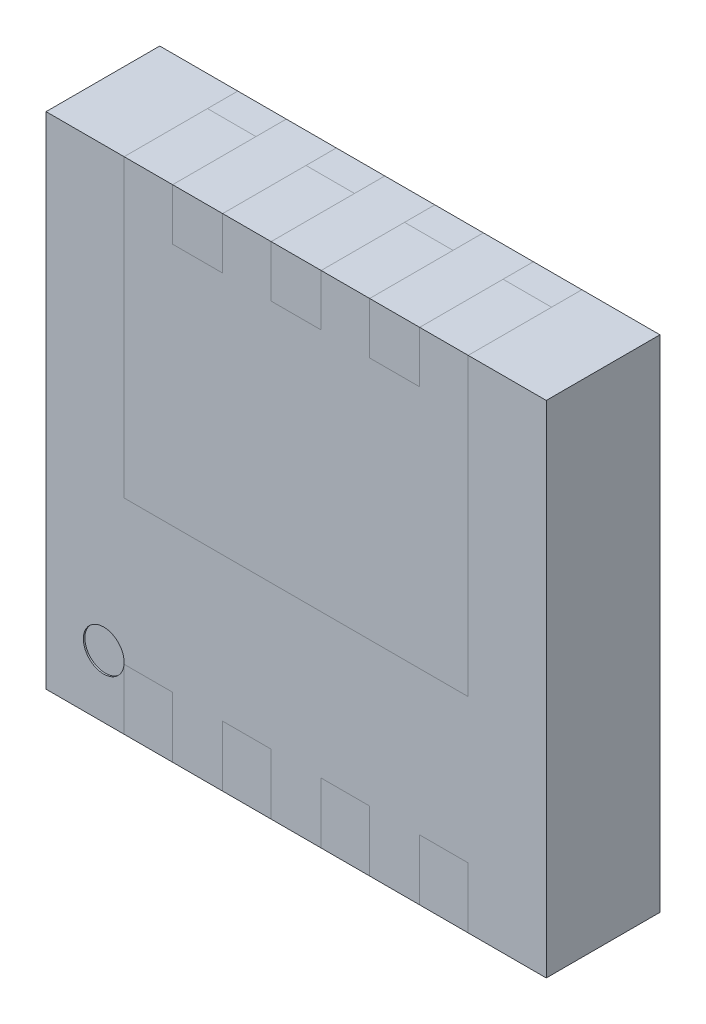
from build123d import *

# Parameters (mm, degrees)
SKETCH1_W             = 0.32
SKETCH1_H             = 0.4
BOSS_EXTRUDE1_DEPTH   = 0.2
BOSS_EXTRUDE1_2_DEPTH = 0.2
BOSS_EXTRUDE1_3_DEPTH = 0.2
BOSS_EXTRUDE1_4_DEPTH = 0.2
BOSS_EXTRUDE1_5_DEPTH = 0.2
BOSS_EXTRUDE4_DEPTH   = 0.75
SKETCH1_5_W           = 0.33
SKETCH1_5_H           = 0.34
BOSS_EXTRUDE4_2_DEPTH = 0.75
BOSS_EXTRUDE4_3_DEPTH = 0.75
BOSS_EXTRUDE4_4_DEPTH = 0.75
BOSS_EXTRUDE7_START   = 0.2
SKETCH1_7_W           = 0.32
SKETCH1_7_H           = 0.4
BOSS_EXTRUDE7_DEPTH   = 0.55
BOSS_EXTRUDE7_2_DEPTH = 0.55
BOSS_EXTRUDE7_3_DEPTH = 0.55
BOSS_EXTRUDE7_4_DEPTH = 0.55
BOSS_EXTRUDE7_5_DEPTH = 0.55
SKETCH3_R             = 0.134470163
CUT_EXTRUDE1_DEPTH    = 0.01


with BuildPart() as part:
    # Sketch1 → Boss-Extrude1 (new body)
    with BuildSketch(Plane.XY):
        with Locations((-0.975, -1.45)):
            Rectangle(SKETCH1_W, SKETCH1_H)
    extrude(amount=BOSS_EXTRUDE1_DEPTH)


with BuildPart() as body_2:
    # Sketch1 → Boss-Extrude1 2 (new body)
    with BuildSketch(Plane.XY):
        Polygon((-0.815, 1.65), (-1.135, 1.65), (-1.135, -0.3), (1.135, -0.3), (1.135, 1.65), (0.815, 1.65), (0.815, 1.31), (0.485, 1.31), (0.485, 1.65), (0.165, 1.65), (0.165, 1.31), (-0.165, 1.31), (-0.165, 1.65), (-0.485, 1.65), (-0.485, 1.31), (-0.815, 1.31), align=None)
    extrude(amount=BOSS_EXTRUDE1_2_DEPTH)


with BuildPart() as body_3:
    # Sketch1 → Boss-Extrude1 3 (new body)
    with BuildSketch(Plane.XY):
        with Locations((-0.325, -1.45)):
            Rectangle(SKETCH1_W, SKETCH1_H)
    extrude(amount=BOSS_EXTRUDE1_3_DEPTH)


with BuildPart() as body_4:
    # Sketch1 → Boss-Extrude1 4 (new body)
    with BuildSketch(Plane.XY):
        with Locations((0.325, -1.45)):
            Rectangle(SKETCH1_W, SKETCH1_H)
    extrude(amount=BOSS_EXTRUDE1_4_DEPTH)


with BuildPart() as body_5:
    # Sketch1 → Boss-Extrude1 5 (new body)
    with BuildSketch(Plane.XY):
        with Locations((0.975, -1.45)):
            Rectangle(SKETCH1_W, SKETCH1_H)
    extrude(amount=BOSS_EXTRUDE1_5_DEPTH)


with BuildPart() as body_6:
    # Sketch1<5> → Boss-Extrude4 (new body)
    with BuildSketch(Plane.XY):
        Polygon((-1.65, 1.65), (-1.65, -1.65), (-1.135, -1.65), (-1.135, -1.25), (-0.815, -1.25), (-0.815, -1.65), (-0.485, -1.65), (-0.485, -1.25), (-0.165, -1.25), (-0.165, -1.65), (0.165, -1.65), (0.165, -1.25), (0.485, -1.25), (0.485, -1.65), (0.815, -1.65), (0.815, -1.25), (1.135, -1.25), (1.135, -1.65), (1.65, -1.65), (1.65, 1.65), (1.135, 1.65), (1.135, -0.3), (-1.135, -0.3), (-1.135, 1.65), align=None)
    extrude(amount=BOSS_EXTRUDE4_DEPTH)

    # Sketch3 → Cut-Extrude1 (cut)
    with BuildSketch(Plane.XY.offset(0.75)):
        with Locations((-1.269470163, -1.23882778)):
            Circle(SKETCH3_R)
    extrude(amount=-CUT_EXTRUDE1_DEPTH, mode=Mode.SUBTRACT)


with BuildPart() as body_7:
    # Sketch1<5> → Boss-Extrude4 2 (new body)
    with BuildSketch(Plane.XY):
        with Locations((-0.65, 1.48)):
            Rectangle(SKETCH1_5_W, SKETCH1_5_H)
    extrude(amount=BOSS_EXTRUDE4_2_DEPTH)


with BuildPart() as body_8:
    # Sketch1<5> → Boss-Extrude4 3 (new body)
    with BuildSketch(Plane.XY):
        with Locations((0, 1.48)):
            Rectangle(SKETCH1_5_W, SKETCH1_5_H)
    extrude(amount=BOSS_EXTRUDE4_3_DEPTH)


with BuildPart() as body_9:
    # Sketch1<5> → Boss-Extrude4 4 (new body)
    with BuildSketch(Plane.XY):
        with Locations((0.65, 1.48)):
            Rectangle(SKETCH1_5_W, SKETCH1_5_H)
    extrude(amount=BOSS_EXTRUDE4_4_DEPTH)


with BuildPart() as body_10:
    # Sketch1<7> → Boss-Extrude7 (new body)
    with BuildSketch(Plane.XY.offset(BOSS_EXTRUDE7_START)):
        with Locations((-0.975, -1.45)):
            Rectangle(SKETCH1_7_W, SKETCH1_7_H)
    extrude(amount=BOSS_EXTRUDE7_DEPTH)


with BuildPart() as body_11:
    # Sketch1<7> → Boss-Extrude7 2 (new body)
    with BuildSketch(Plane.XY.offset(BOSS_EXTRUDE7_START)):
        Polygon((-0.815, 1.65), (-1.135, 1.65), (-1.135, -0.3), (1.135, -0.3), (1.135, 1.65), (0.815, 1.65), (0.815, 1.31), (0.485, 1.31), (0.485, 1.65), (0.165, 1.65), (0.165, 1.31), (-0.165, 1.31), (-0.165, 1.65), (-0.485, 1.65), (-0.485, 1.31), (-0.815, 1.31), align=None)
    extrude(amount=BOSS_EXTRUDE7_2_DEPTH)


with BuildPart() as body_12:
    # Sketch1<7> → Boss-Extrude7 3 (new body)
    with BuildSketch(Plane.XY.offset(BOSS_EXTRUDE7_START)):
        with Locations((-0.325, -1.45)):
            Rectangle(SKETCH1_7_W, SKETCH1_7_H)
    extrude(amount=BOSS_EXTRUDE7_3_DEPTH)


with BuildPart() as body_13:
    # Sketch1<7> → Boss-Extrude7 4 (new body)
    with BuildSketch(Plane.XY.offset(BOSS_EXTRUDE7_START)):
        with Locations((0.325, -1.45)):
            Rectangle(SKETCH1_7_W, SKETCH1_7_H)
    extrude(amount=BOSS_EXTRUDE7_4_DEPTH)


with BuildPart() as body_14:
    # Sketch1<7> → Boss-Extrude7 5 (new body)
    with BuildSketch(Plane.XY.offset(BOSS_EXTRUDE7_START)):
        with Locations((0.975, -1.45)):
            Rectangle(SKETCH1_7_W, SKETCH1_7_H)
    extrude(amount=BOSS_EXTRUDE7_5_DEPTH)


solid = Compound([part.part, body_2.part, body_3.part, body_4.part, body_5.part, body_6.part, body_7.part, body_8.part, body_9.part, body_10.part, body_11.part, body_12.part, body_13.part, body_14.part])
